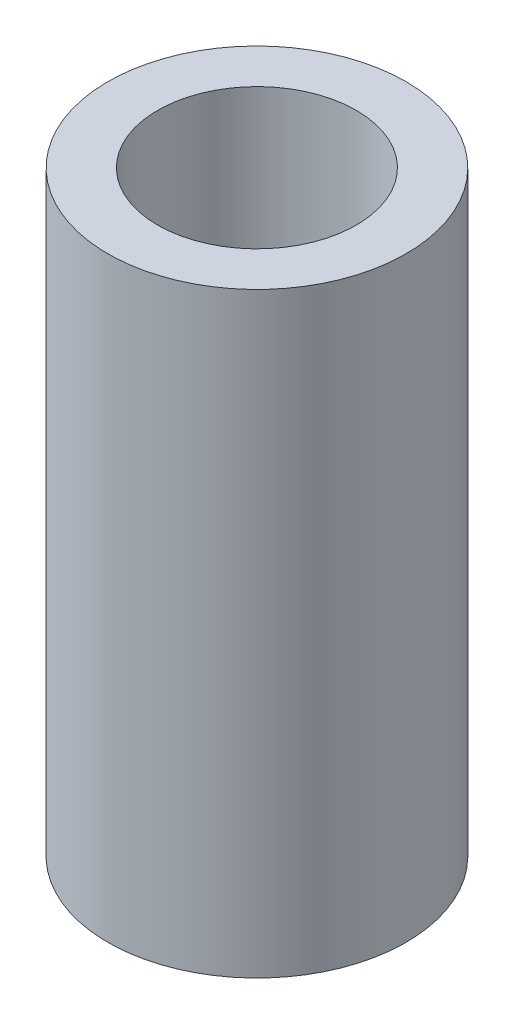
from build123d import *

# Parameters (mm, degrees)
SKETCH1_R           = 4.7625
SKETCH1_R_2         = 3.175
BOSS_EXTRUDE1_DEPTH = 19.05


with BuildPart() as part:
    # Sketch1 → Boss-Extrude1 (new body)
    with BuildSketch(Plane(origin=(0, 0, 0), x_dir=(1, 0, 0), z_dir=(0, 1, 0))):
        with Locations(Location((0, 0, 0), (0, 0, 90))):
            Circle(SKETCH1_R)
        with Locations(Location((0, 0, 0), (0, 0, 90))):
            Circle(SKETCH1_R_2, mode=Mode.SUBTRACT)
    extrude(amount=BOSS_EXTRUDE1_DEPTH)


solid = part.part
